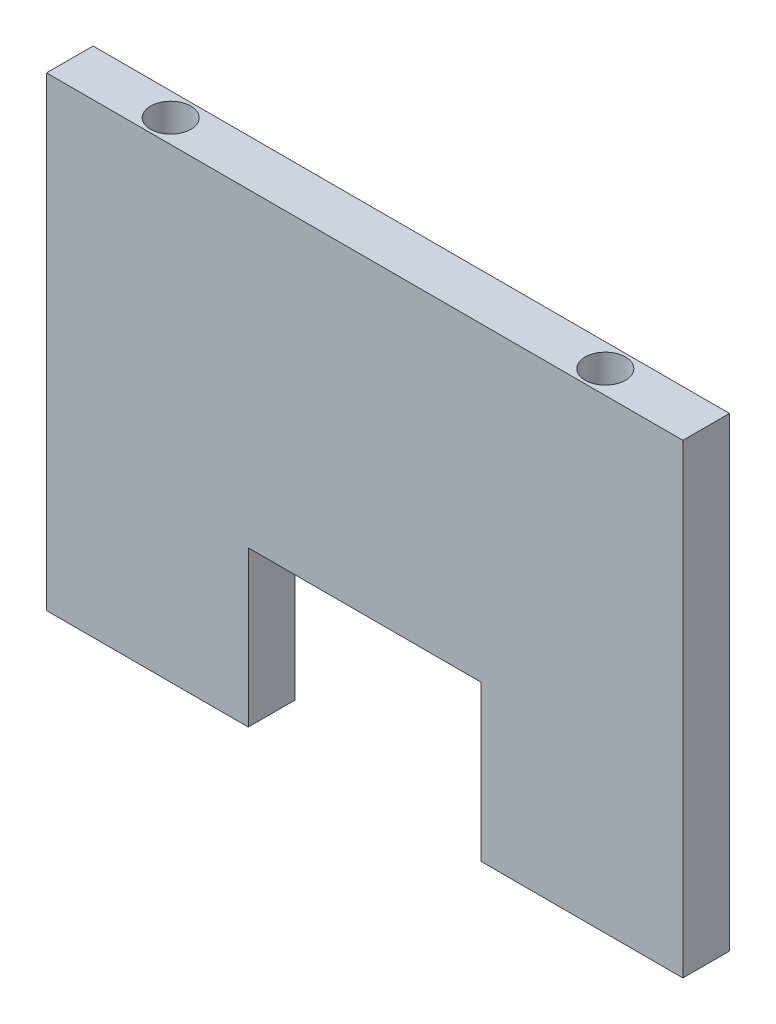
from build123d import *

# Parameters (mm, degrees)
SKETCH3_W           = 52.07
SKETCH3_H           = 38.1
BOSS_EXTRUDE2_DEPTH = 3.81
SKETCH4_W           = 19.05
SKETCH4_H           = 12.7
CUT_EXTRUDE1_DEPTH  = 65.632894102
SKETCH6_R           = 1.651
CUT_EXTRUDE2_DEPTH  = 5.08
CUT_EXTRUDE3_START  = -5.08
SKETCH8_R           = 1.651
CUT_EXTRUDE3_DEPTH  = 5.08


with BuildPart() as part:
    # Sketch3 → Boss-Extrude2 (new body)
    with BuildSketch(Plane.XY):
        with Locations((26.035, 19.05)):
            Rectangle(SKETCH3_W, SKETCH3_H)
    extrude(amount=BOSS_EXTRUDE2_DEPTH)

    # Sketch4 → Cut-Extrude1 (cut, through all)
    with BuildSketch(Plane.XY.offset(3.81)):
        with Locations((26.035, 6.35)):
            Rectangle(SKETCH4_W, SKETCH4_H)
    extrude(amount=-CUT_EXTRUDE1_DEPTH, mode=Mode.SUBTRACT)

    # Sketch6 → Cut-Extrude2 (cut)
    with BuildSketch(Plane.XZ):
        with Locations(Location((8.255, 1.905, 0), (0, 0, 270))):
            Circle(SKETCH6_R)
        with Locations(Location((43.815, 1.905, 0), (0, 0, 270))):
            Circle(SKETCH6_R)
    extrude(amount=-CUT_EXTRUDE2_DEPTH, mode=Mode.SUBTRACT)

    # Sketch8 → Cut-Extrude3 (cut)
    with BuildSketch(Plane(origin=(0, 38.1, 0), x_dir=(1, 0, 0), z_dir=(0, 1, 0)).offset(CUT_EXTRUDE3_START)):
        with Locations(Location((8.255, -1.905, 0), (0, 0, 90))):
            Circle(SKETCH8_R)
        with Locations(Location((43.815, -1.905, 0), (0, 0, 90))):
            Circle(SKETCH8_R)
    extrude(amount=CUT_EXTRUDE3_DEPTH, mode=Mode.SUBTRACT)


solid = part.part
